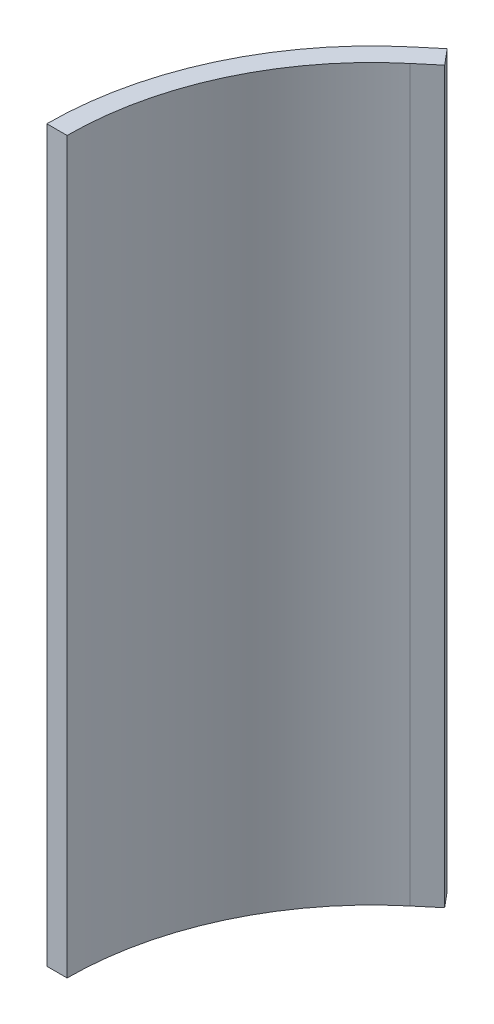
from build123d import *

# Parameters (mm, degrees)
SKETCH1_R           = 2.6
BOSS_EXTRUDE1_DEPTH = 20
BOSS_EXTRUDE2_DEPTH = 20
BOSS_EXTRUDE3_DEPTH = 180
CUT_EXTRUDE1_DEPTH  = 195.584574731


with BuildPart() as part:
    # Sketch1 → Boss-Extrude1 (new body)
    with BuildSketch(Plane(origin=(0, 0, 0), x_dir=(1, 0, 0), z_dir=(0, 1, 0))):
        with BuildLine():
            Line((10, 0), (-10, 0))
            ThreePointArc((-10, 0), (-2.947752983, 31.810630591), (16.887506811, 57.660444431))
            Line((16.887506811, 57.660444431), (29.743259005, 42.339555569))
            ThreePointArc((29.743259005, 42.339555569), (15.178402758, 23.358265357), (10, 0))
        make_face()
        with Locations(Location((0.770593323, 10, 0), (0, 0, 270))):
            Circle(SKETCH1_R, mode=Mode.SUBTRACT)
        with Locations(Location((6.115324888, 27.584447974, 0), (0, 0, 270))):
            Circle(SKETCH1_R, mode=Mode.SUBTRACT)
        with Locations(Location((16.150266317, 42.98181517, 0), (0, 0, 270))):
            Circle(SKETCH1_R, mode=Mode.SUBTRACT)
    extrude(amount=BOSS_EXTRUDE1_DEPTH)

    # Sketch2 → Boss-Extrude2 (add)
    with BuildSketch(Plane(origin=(0, 20, 0), x_dir=(1, 0, 0), z_dir=(0, 1, 0))):
        Polygon((16.887506811, 57.660444431), (29.743259005, 42.339555569), (34.416130108, 46.260559988), (21.560377914, 61.58144885), align=None)
    extrude(amount=-BOSS_EXTRUDE2_DEPTH)

    # Sketch4 → Cut-Extrude1 (cut, through all)
    with BuildSketch(Plane(origin=(0, 20, 0), x_dir=(1, 0, 0), z_dir=(0, 1, 0))):
        with BuildLine():
            Line((29.743259005, 42.339555569), (34.416130108, 46.260559988))
            Line((34.416130108, 46.260559988), (21.560377914, 61.58144885))
            Line((21.560377914, 61.58144885), (16.887506811, 57.660444431))
            ThreePointArc((16.887506811, 57.660444431), (-2.947752983, 31.810630591), (-10, 0))
            Line((-10, 0), (10, 0))
            ThreePointArc((10, 0), (15.178402758, 23.358265357), (29.743259005, 42.339555569))
        make_face()
    extrude(amount=-CUT_EXTRUDE1_DEPTH, mode=Mode.SUBTRACT)


with BuildPart() as body_2:
    # Sketch3 → Boss-Extrude3 (new body)
    with BuildSketch(Plane(origin=(0, 20, 0), x_dir=(1, 0, 0), z_dir=(0, 1, 0))):
        with BuildLine():
            Line((18.346439865, 65.411671066), (13.673568762, 61.490666647))
            ThreePointArc((13.673568762, 61.490666647), (-7.479291918, 33.9237219), (-15, 0))
            Line((-15, 0), (-10, 0))
            ThreePointArc((-10, 0), (-2.947752983, 31.810630591), (16.887506811, 57.660444431))
            Line((16.887506811, 57.660444431), (21.560377914, 61.58144885))
            Line((21.560377914, 61.58144885), (18.346439865, 65.411671066))
        make_face()
    extrude(amount=BOSS_EXTRUDE3_DEPTH)


solid = body_2.part
